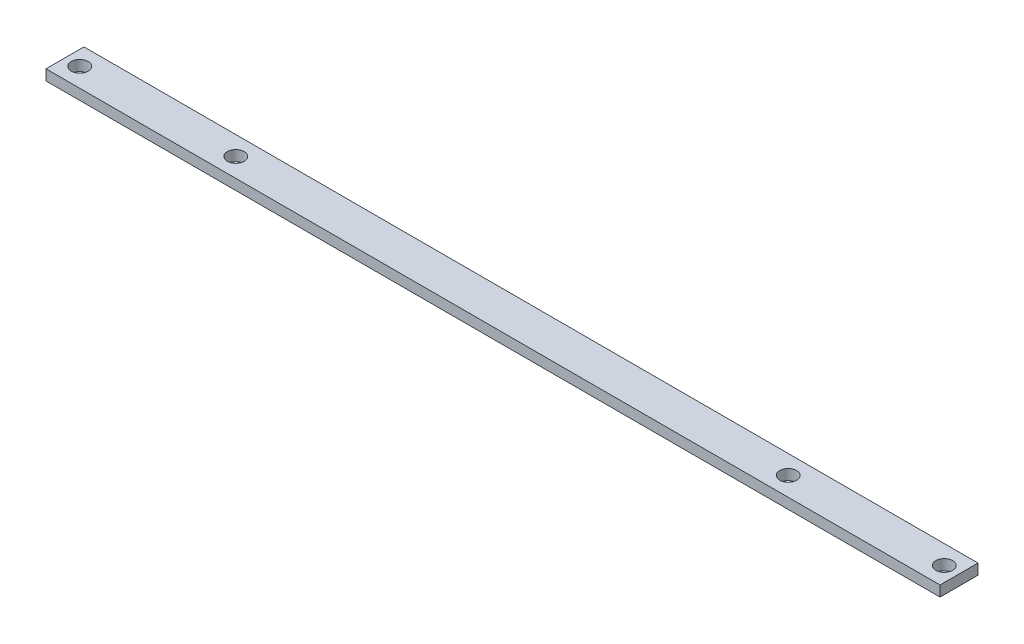
from build123d import *

# Parameters (mm, degrees)
SKETCH1_W           = 212
SKETCH1_H           = 9
SKETCH1_R           = 2
BOSS_EXTRUDE1_DEPTH = 2.5


with BuildPart() as part:
    # Sketch1 → Boss-Extrude1 (new body)
    with BuildSketch(Plane(origin=(0, 0, 0), x_dir=(1, 0, 0), z_dir=(0, 1, 0))):
        with Locations((106, 4.5)):
            Rectangle(SKETCH1_W, SKETCH1_H)
        with Locations(Location((3.5, 4.5, 0), (0, 0, 270))):
            Circle(SKETCH1_R, mode=Mode.SUBTRACT)
        with Locations(Location((40.5, 4.5, 0), (0, 0, 270))):
            Circle(SKETCH1_R, mode=Mode.SUBTRACT)
        with Locations(Location((171.5, 4.5, 0), (0, 0, 270))):
            Circle(SKETCH1_R, mode=Mode.SUBTRACT)
        with Locations(Location((208.5, 4.5, 0), (0, 0, 270))):
            Circle(SKETCH1_R, mode=Mode.SUBTRACT)
    extrude(amount=BOSS_EXTRUDE1_DEPTH)


solid = part.part
